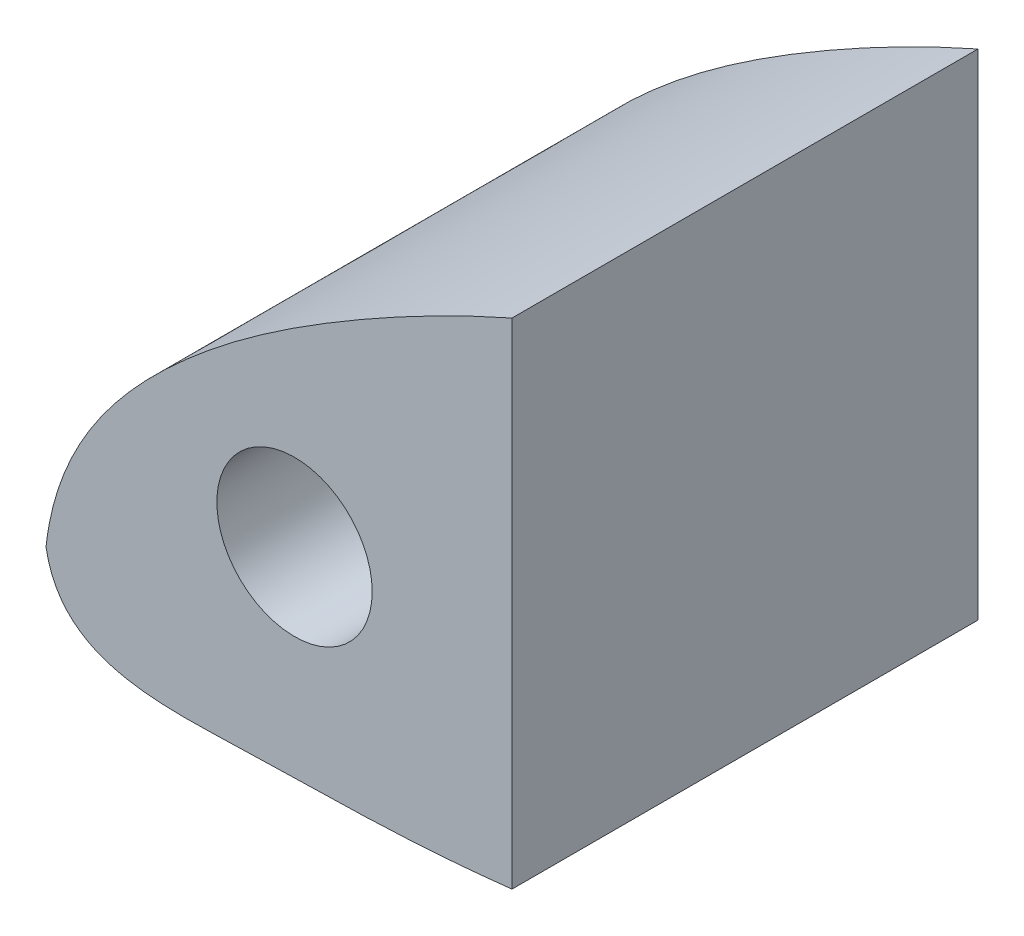
from build123d import *

# Parameters (mm, degrees)
BOSS_EXTRUDE1_DEPTH = 38.1
SKETCH2_R           = 6.35
SKETCH2_R_2         = 3.175
CUT_EXTRUDE1_DEPTH  = 319.018514003
SKETCH3_W           = 293.188888759
SKETCH3_H           = 137.971241769
CUT_EXTRUDE2_DEPTH  = 319.018514003


with BuildPart() as part:
    # Sketch1 → Boss-Extrude1 (new body)
    with BuildSketch(Plane.XY):
        with BuildLine():
            add(Edge.make_bspline(
                [(0.000560351, 0.000130087), (0.810633127, 7.359196055), (8.649092025, 17.856605174), (26.286719818, 29.975176328), (52.111128271, 42.069215275), (89.597618475, 49.290763054), (131.400792109, 47.884831915), (173.256699242, 40.041104278), (217.961060472, 29.612974894), (256.952064401, 19.528920948), (290.35983767, 8.71099439), (301.273197721, 4.382828139), (314.816918223, -0.516206742), (309.846313895, 0.000130087)],
                knots=[0, 0, 0, 0, 0.060863618, 0.113688265, 0.188608742, 0.312908923, 0.448482434, 0.557612135, 0.691544113, 0.852438279, 0.92975597, 0.976058229, 1, 1, 1, 1], degree=3))
            add(Edge.make_bspline(
                [(309.846313895, 0.000130087), (303.956832565, 1.47095521), (293.989507544, 2.093987313), (276.26402299, 4.514356704), (260.846344817, 5.427413394), (235.858814759, 7.870306192), (205.101424636, 8.838080282), (157.718638092, 9.030650149), (110.497331172, 6.181495223), (66.506197185, -0.586669107), (36.454672816, -6.098499901), (15.316603331, -6.189065841), (1.230714189, -6.924076091), (0.000560351, 0.000130087)],
                knots=[0, 0, 0, 0, 0.057787081, 0.095274891, 0.171021118, 0.205339302, 0.335319146, 0.464904334, 0.658702312, 0.785511947, 0.893517288, 0.94309214, 1, 1, 1, 1], degree=3))
        make_face()
    extrude(amount=BOSS_EXTRUDE1_DEPTH)

    # Sketch2 → Cut-Extrude1 (cut, through all)
    with BuildSketch(Plane.XY.offset(38.1)):
        with Locations((20.32, 10.16)):
            Circle(SKETCH2_R)
        with Locations((227.296313895, 19.050130087)):
            Circle(SKETCH2_R_2)
    extrude(amount=-CUT_EXTRUDE1_DEPTH, mode=Mode.SUBTRACT)

    # Sketch3 → Cut-Extrude2 (cut, through all)
    with BuildSketch(Plane.XY.offset(38.1)):
        with Locations((184.69444438, 2.732377951)):
            Rectangle(SKETCH3_W, SKETCH3_H)
    extrude(amount=-CUT_EXTRUDE2_DEPTH, mode=Mode.SUBTRACT)


solid = part.part
